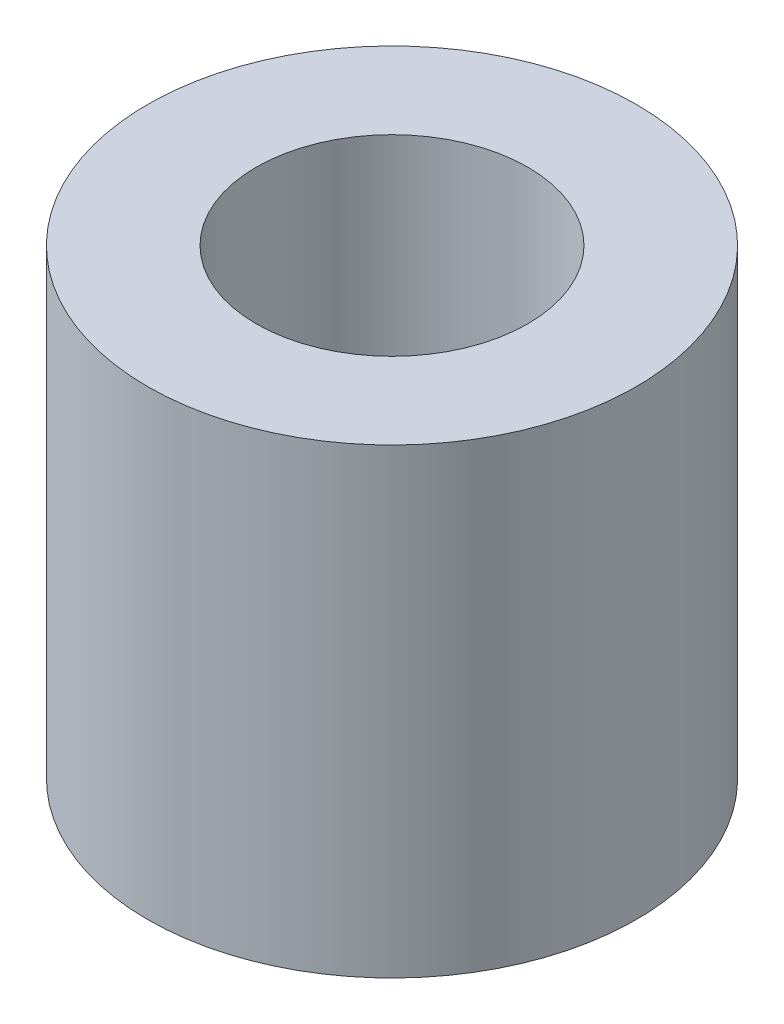
from build123d import *

# Parameters (mm, degrees)
SKETCH1_R           = 1.8
SKETCH1_R_2         = 1
BOSS_EXTRUDE1_DEPTH = 3.4


with BuildPart() as part:
    # Sketch1 → Boss-Extrude1 (new body)
    with BuildSketch(Plane(origin=(0, 0, 0), x_dir=(1, 0, 0), z_dir=(0, 1, 0))):
        with Locations(Location((0, 0, 0), (0, 0, 270))):
            Circle(SKETCH1_R)
        with Locations(Location((0, 0, 0), (0, 0, 270))):
            Circle(SKETCH1_R_2, mode=Mode.SUBTRACT)
    extrude(amount=BOSS_EXTRUDE1_DEPTH)


solid = part.part
